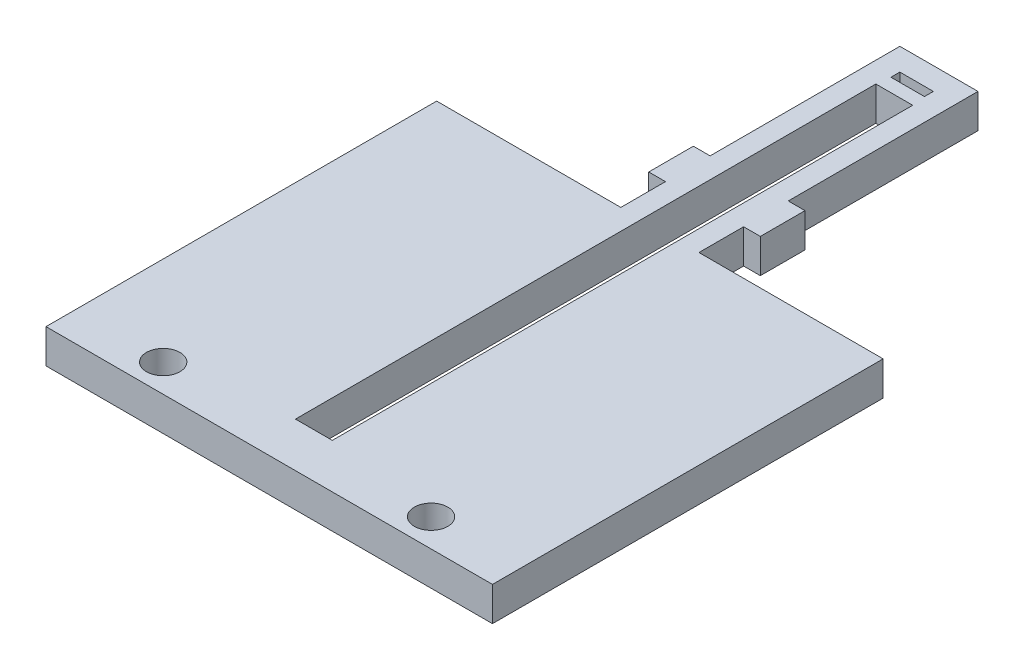
from build123d import *

# Parameters (mm, degrees)
SKETCH1_W           = 40
SKETCH1_H           = 60
BOSS_EXTRUDE1_DEPTH = 3.05
SKETCH4_W           = 3.3
SKETCH4_H           = 52
SKETCH4_W_2         = 3
SKETCH4_H_2         = 0.8
CUT_EXTRUDE1_DEPTH  = 10
CUT_EXTRUDE3_DEPTH  = 10
SKETCH7_R           = 1.5
CUT_EXTRUDE4_DEPTH  = 10


with BuildPart() as part:
    # Sketch1 → Boss-Extrude1 (new body)
    with BuildSketch(Plane(origin=(0, 0, 0), x_dir=(1, 0, 0), z_dir=(0, 1, 0))):
        with Locations((20, 30)):
            Rectangle(SKETCH1_W, SKETCH1_H)
    extrude(amount=BOSS_EXTRUDE1_DEPTH)

    # Sketch4 → Cut-Extrude1 (cut)
    with BuildSketch(Plane(origin=(0, 3.05, 0), x_dir=(1, 0, 0), z_dir=(0, 1, 0))):
        with Locations((20, 30)):
            Rectangle(SKETCH4_W, SKETCH4_H)
        with Locations((20, 57.6)):
            Rectangle(SKETCH4_W_2, SKETCH4_H_2)
    extrude(amount=-CUT_EXTRUDE1_DEPTH, mode=Mode.SUBTRACT)

    # Sketch6 → Cut-Extrude3 (cut)
    with BuildSketch(Plane(origin=(0, 3.05, 0), x_dir=(1, 0, 0), z_dir=(0, 1, 0))):
        Polygon((0, 60), (0, 35), (16.5, 35), (16.5, 39), (15, 39), (15, 43), (16.5, 43), (16.5, 60), align=None)
        Polygon((40, 60), (40, 35), (23.5, 35), (23.5, 39), (25, 39), (25, 43), (23.5, 43), (23.5, 60), align=None)
    extrude(amount=-CUT_EXTRUDE3_DEPTH, mode=Mode.SUBTRACT)

    # Sketch7 → Cut-Extrude4 (cut)
    with BuildSketch(Plane(origin=(0, 3.05, 0), x_dir=(1, 0, 0), z_dir=(0, 1, 0))):
        with Locations(Location((8, 2.5, 0), (0, 0, 270))):
            Circle(SKETCH7_R)
        with Locations(Location((32, 2.5, 0), (0, 0, 270))):
            Circle(SKETCH7_R)
    extrude(amount=-CUT_EXTRUDE4_DEPTH, mode=Mode.SUBTRACT)


solid = part.part
